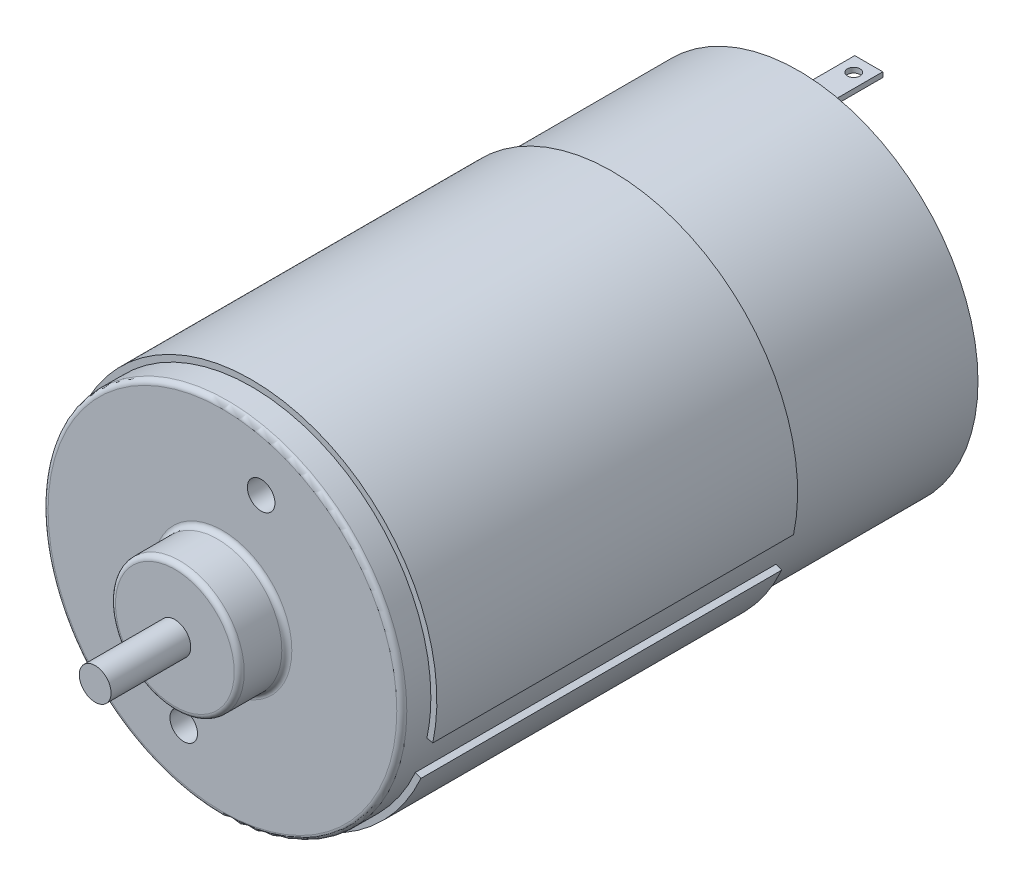
from build123d import *

# Parameters (mm, degrees)
SKETCH1_R                = 17.9
BOSS_EXTRUDE1_DEPTH      = 57.5
SKETCH1_3_R              = 5.3
SKETCH1_3_R_2            = 1.5875
BOSS_EXTRUDE2_DEPTH      = 2.8
BOSS_EXTRUDE4_DEPTH      = 57.5
BOSS_EXTRUDE4_DEPTH_BACK = 2
BOSS_EXTRUDE4_START      = -2.8
SKETCH1_5_R              = 1.5875
BOSS_EXTRUDE5_START      = 70.2
SKETCH1_6_R              = 1.5875
BOSS_EXTRUDE5_DEPTH      = 75
SKETCH2_R                = 1.375
CUT_EXTRUDE1_DEPTH       = 3
SKETCH3_W                = 2.8
SKETCH3_H                = 0.5
BOSS_EXTRUDE6_DEPTH      = 7
SKETCH4_R                = 0.625
CUT_EXTRUDE2_DEPTH       = 80.566701578
SKETCH2_3_R              = 6.425
BOSS_EXTRUDE7_DEPTH      = 4.75
BOSS_EXTRUDE8_START      = -38.9
BOSS_EXTRUDE8_DEPTH      = 36
FILLET1_R                = 0.5


with BuildPart() as part:
    # Sketch1 → Boss-Extrude1 (new body)
    with BuildSketch(Plane.XY):
        Circle(SKETCH1_R)
    extrude(amount=BOSS_EXTRUDE1_DEPTH)

    # Sketch1<3> → Boss-Extrude2 (add)
    with BuildSketch(Plane.XY):
        Circle(SKETCH1_3_R)
        Circle(SKETCH1_3_R_2, mode=Mode.SUBTRACT)
    extrude(amount=-BOSS_EXTRUDE2_DEPTH)

    # Sketch1<5> → Boss-Extrude4 (add, two sides: drawn at the far end of the back side and taken through both)
    with BuildSketch(Plane.XY.offset(BOSS_EXTRUDE4_START - BOSS_EXTRUDE4_DEPTH_BACK)):
        Circle(SKETCH1_5_R)
    extrude(amount=BOSS_EXTRUDE4_DEPTH + BOSS_EXTRUDE4_DEPTH_BACK)

    # Sketch1<6> → Boss-Extrude5 (add)
    with BuildSketch(Plane.XY.offset(BOSS_EXTRUDE5_START)):
        Circle(SKETCH1_6_R)
    extrude(amount=-BOSS_EXTRUDE5_DEPTH)

    # Sketch2 → Cut-Extrude1 (cut)
    with BuildSketch(Plane.XY.offset(57.5)):
        with Locations((3.86271243, 11.888206454)):
            Circle(SKETCH2_R)
        with Locations((-3.86271243, -11.888206454)):
            Circle(SKETCH2_R)
    extrude(amount=-CUT_EXTRUDE1_DEPTH, mode=Mode.SUBTRACT)

    # Sketch3 → Boss-Extrude6 (add)
    with BuildSketch(Plane(origin=(0, 0, 0), x_dir=(-1, 0, 0), z_dir=(0, 0, -1))):
        with Locations((0, -14.75)):
            Rectangle(SKETCH3_W, SKETCH3_H)
        with Locations((0, 14.75)):
            Rectangle(SKETCH3_W, SKETCH3_H)
    extrude(amount=BOSS_EXTRUDE6_DEPTH)

    # Sketch4 → Cut-Extrude2 (cut, through all)
    with BuildSketch(Plane(origin=(0, 15, 0), x_dir=(1, 0, 0), z_dir=(0, 1, 0))):
        with Locations(Location((0, 5.5, 0), (0, 0, 270))):
            Circle(SKETCH4_R)
    extrude(amount=-CUT_EXTRUDE2_DEPTH, mode=Mode.SUBTRACT)

    # Sketch2<3> → Boss-Extrude7 (add)
    with BuildSketch(Plane.XY.offset(57.5)):
        Circle(SKETCH2_3_R)
    extrude(amount=BOSS_EXTRUDE7_DEPTH)

    # Sketch5 → Boss-Extrude8 (add)
    with BuildSketch(Plane.XY.offset(57.5).offset(BOSS_EXTRUDE8_START)):
        with BuildLine():
            Line((17.50706481, -3.729970743), (18.093893798, -3.854997695))
            ThreePointArc((18.093893798, -3.854997695), (-17.594545551, 5.716814396), (16.90417837, -7.516565283))
            Line((16.90417837, -7.516565283), (16.355934747, -7.272784787))
            ThreePointArc((16.355934747, -7.272784787), (-17.509729181, 3.717443209), (17.9, 0))
            ThreePointArc((17.9, 0), (17.801495163, -1.875305295), (17.50706481, -3.729970743))
        make_face()
    extrude(amount=BOSS_EXTRUDE8_DEPTH)

    # Fillet1
    fillet1_edges = [part.edges().sort_by_distance(p)[0] for p in [
        (-17.9, 0, 57.5),
        (-5.3, 0, -2.8),
        (-6.425, 0, 57.5),
        (-6.425, 0, 62.25),
    ]]
    fillet(fillet1_edges, radius=FILLET1_R)


solid = part.part
